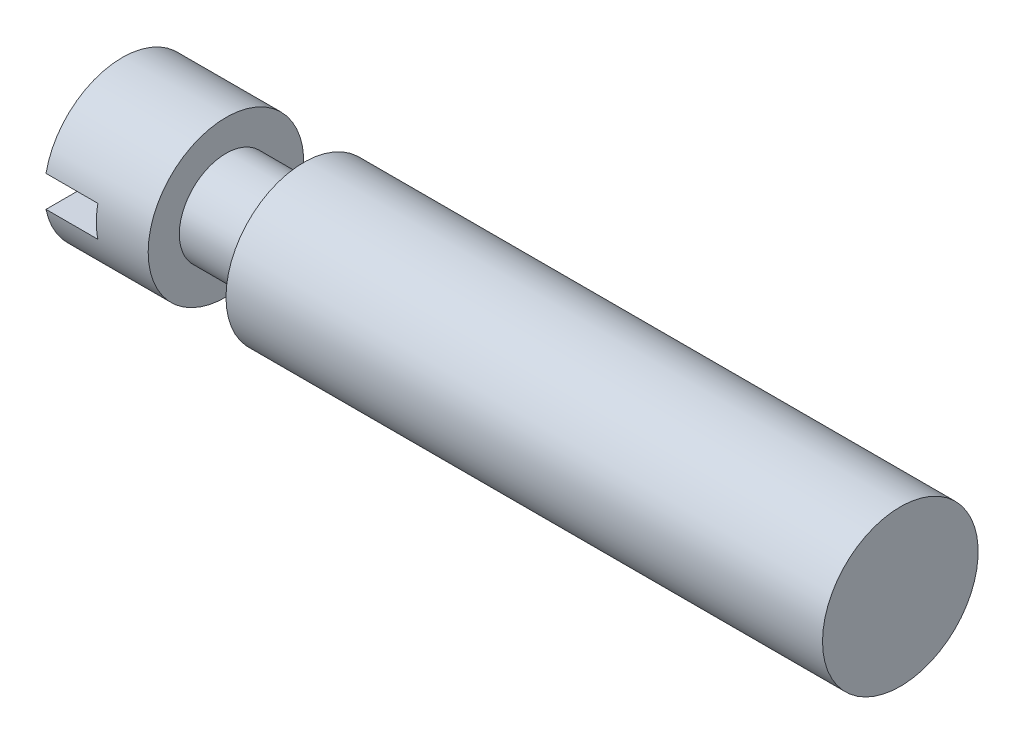
from build123d import *

# Parameters (mm, degrees)
CUT_EXTRUDE1_DEPTH      = 31.298514815
CUT_EXTRUDE1_DEPTH_BACK = 31.298514815
SKETCH2_W               = 2
SKETCH2_H               = 1.2


with BuildPart() as part:
    # Sketch1 → Revolve1 (revolve)
    with BuildSketch(Plane.XY, mode=Mode.PRIVATE) as revolve1_sk:
        Polygon((4, 3), (4, 1.8), (7, 1.8), (7, 3), (30, 3), (30, 0), (0, 0), (0, 3), align=None)
    revolve(revolve1_sk.sketch.rotate(Axis((0, 0, 0), (1, 0, 0)), 90), axis=Axis((0, 0, 0), (1, 0, 0)))

    # Sketch2 → Cut-Extrude1 (cut, two sides: drawn at the far end of the back side and taken through both)
    with BuildSketch(Plane.XY.offset(-CUT_EXTRUDE1_DEPTH_BACK)):
        with Locations((1, 0)):
            Rectangle(SKETCH2_W, SKETCH2_H)
    extrude(amount=CUT_EXTRUDE1_DEPTH + CUT_EXTRUDE1_DEPTH_BACK, mode=Mode.SUBTRACT)


solid = part.part
